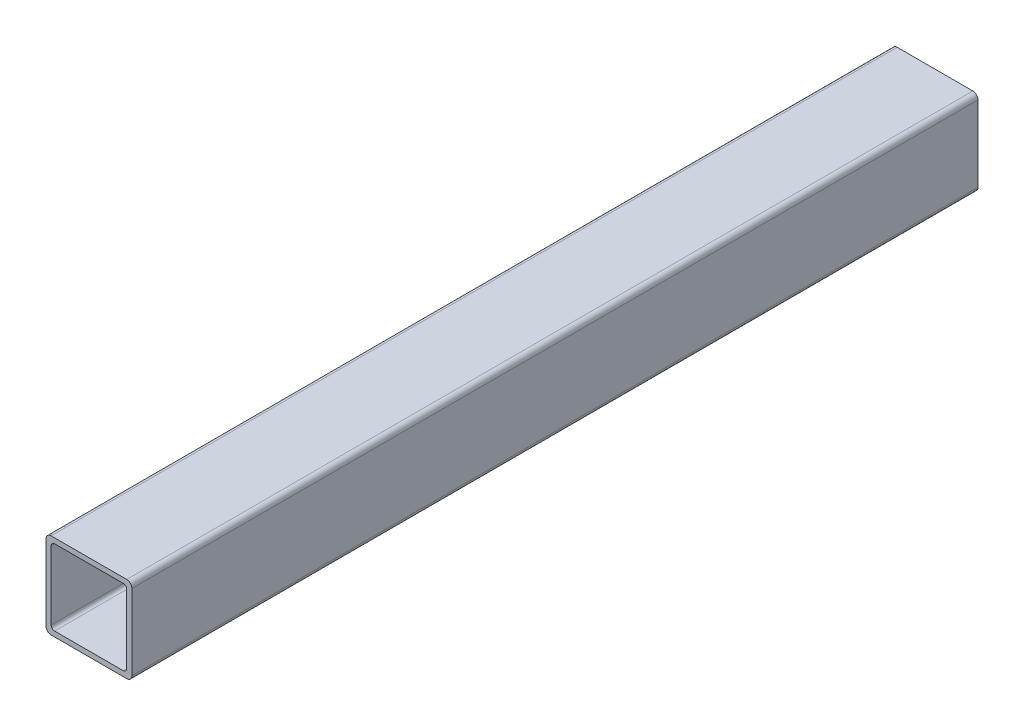
from build123d import *

# Parameters (mm, degrees)
EXTRUDE_START   = -492.5
EXTRUDE_1_DEPTH = 492.5


with BuildPart() as part:
    # Эскиз1 → Бобышка-Вытянуть1 (new body)
    with BuildSketch(Plane.XY.offset(EXTRUDE_START)):
        with BuildLine():
            Line((-22, 50), (22, 50))
            ThreePointArc((22, 50), (24.121320344, 49.121320344), (25, 47))
            Line((25, 47), (25, 3))
            ThreePointArc((25, 3), (24.121320344, 0.878679656), (22, 0))
            Line((22, 0), (-22, 0))
            ThreePointArc((-22, 0), (-24.121320344, 0.878679656), (-25, 3))
            Line((-25, 3), (-25, 47))
            ThreePointArc((-25, 47), (-24.121320344, 49.121320344), (-22, 50))
        make_face()
        with BuildLine():
            Line((-20, 47), (20, 47))
            ThreePointArc((20, 47), (21.414213562, 46.414213562), (22, 45))
            Line((22, 45), (22, 5))
            ThreePointArc((22, 5), (21.414213562, 3.585786438), (20, 3))
            Line((20, 3), (-20, 3))
            ThreePointArc((-20, 3), (-21.414213562, 3.585786438), (-22, 5))
            Line((-22, 5), (-22, 45))
            ThreePointArc((-22, 45), (-21.414213562, 46.414213562), (-20, 47))
        make_face(mode=Mode.SUBTRACT)
    extrude(amount=EXTRUDE_1_DEPTH)


solid = part.part
